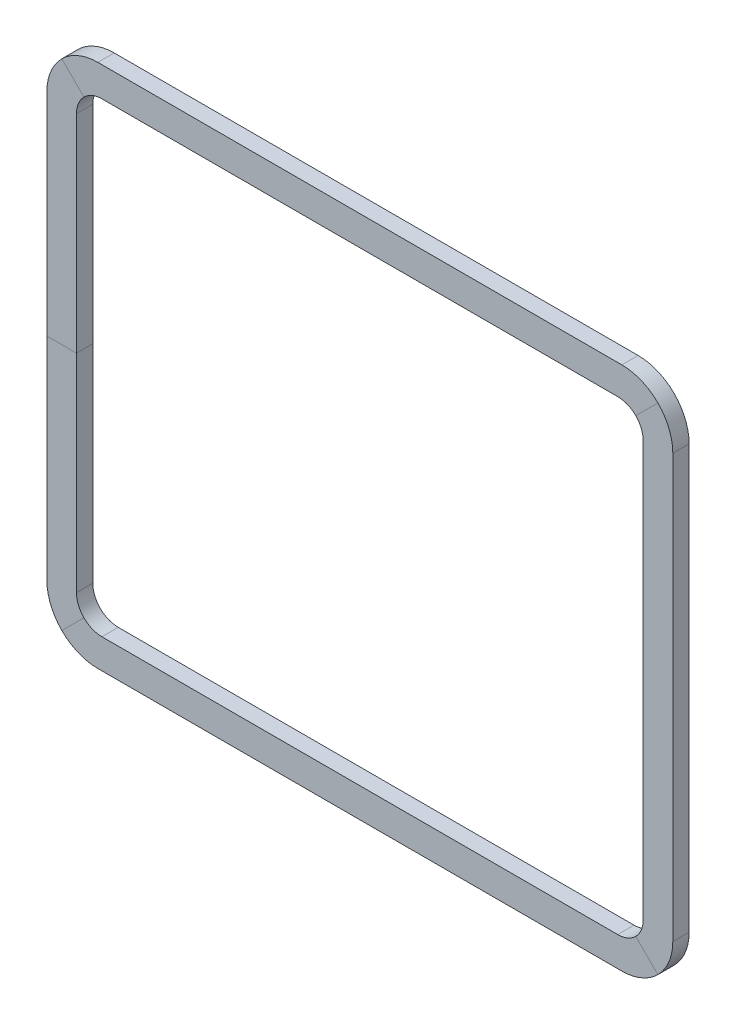
from build123d import *

# Parameters (mm, degrees)
SKETCH2_W = 2.9
SKETCH2_H = 1.6
FILLET1_R = 5
FILLET2_R = 2.5


with BuildPart() as part:
    # Sweep1: sweep along a path in Sketch1
    with BuildLine(Plane.XY) as sweep1_path:
        Line((-30.7, 25.75), (30.7, 25.75))
        Line((30.7, 25.75), (30.7, -25.75))
        Line((30.7, -25.75), (-30.7, -25.75))
        Line((-30.7, -25.75), (-30.7, 25.75))
    # Sketch2 → Sweep1 (sweep)
    with BuildSketch(Plane(origin=(0, 0, 0), x_dir=(1, 0, 0), z_dir=(0, 1, 0))):
        with Locations((-29.25, -0.8)):
            Rectangle(SKETCH2_W, SKETCH2_H)
    sweep(path=sweep1_path.line, transition=Transition.RIGHT)

    # Fillet1
    fillet1_edges = [part.edges().sort_by_distance(p)[0] for p in [
        (30.7, -25.75, 0.8),
        (-30.7, -25.75, 0.8),
        (30.7, 25.75, 0.8),
        (-30.7, 25.75, 0.8),
    ]]
    fillet(fillet1_edges, radius=FILLET1_R)

    # Fillet2
    fillet2_edges = [part.edges().sort_by_distance(p)[0] for p in [
        (27.8, -22.85, 0.8),
        (-27.8, -22.85, 0.8),
        (27.8, 22.85, 0.8),
        (-27.8, 22.85, 0.8),
    ]]
    fillet(fillet2_edges, radius=FILLET2_R)


solid = part.part
